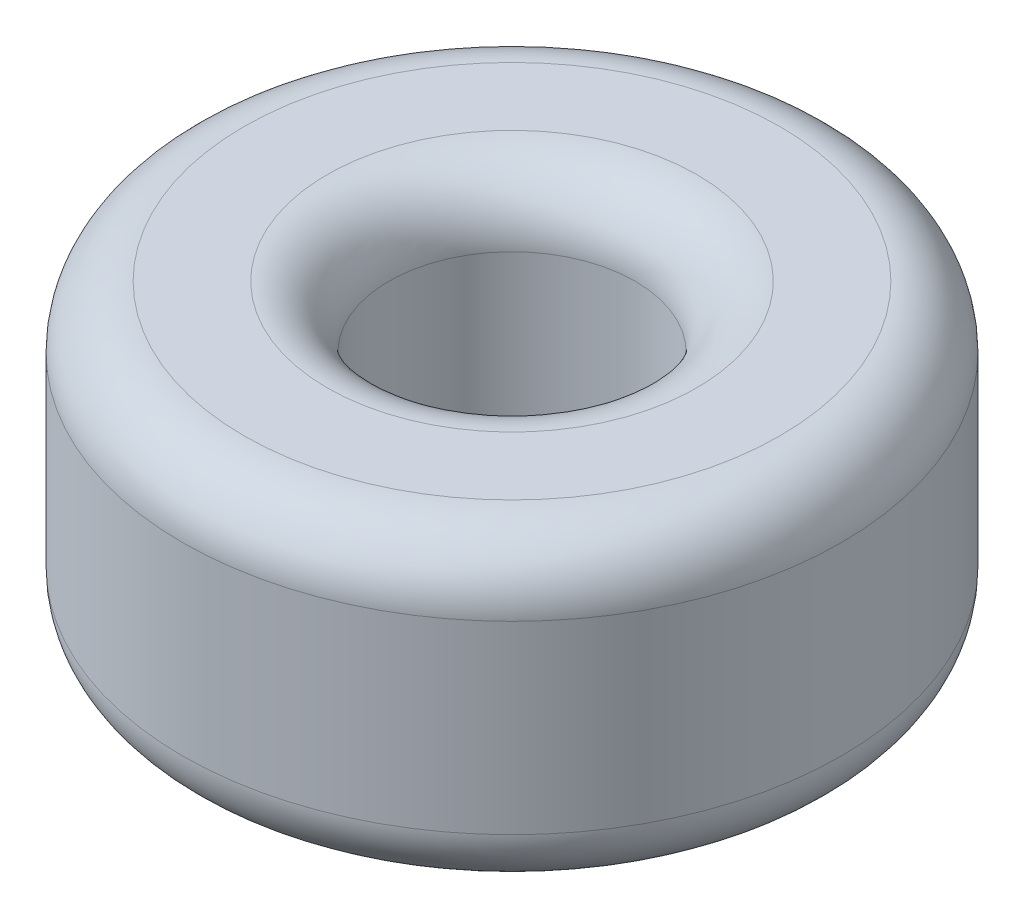
from build123d import *

# Parameters (mm, degrees)
SKETCH1_R           = 53.5
SKETCH1_R_2         = 20
BOSS_EXTRUDE1_DEPTH = 50
FILLET1_R           = 10


with BuildPart() as part:
    # Sketch1 → Boss-Extrude1 (new body)
    with BuildSketch(Plane(origin=(0, 0, 0), x_dir=(1, 0, 0), z_dir=(0, 1, 0))):
        with Locations(Location((0, 0, 0), (0, 0, 270))):
            Circle(SKETCH1_R)
        with Locations(Location((0, 0, 0), (0, 0, 270))):
            Circle(SKETCH1_R_2, mode=Mode.SUBTRACT)
    extrude(amount=BOSS_EXTRUDE1_DEPTH)

    # Fillet1
    fillet1_edges = [part.edges().sort_by_distance(p)[0] for p in [
        (0, 0, -53.5),
        (0, 50, -53.5),
        (0, 0, -20),
        (0, 50, -20),
    ]]
    fillet(fillet1_edges, radius=FILLET1_R)


solid = part.part
